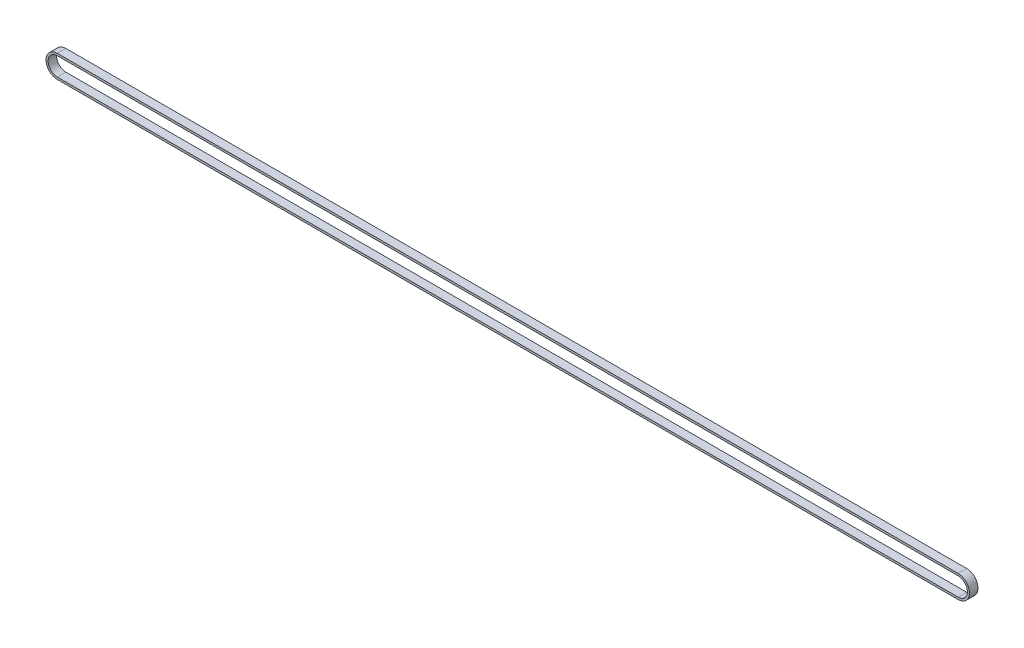
from build123d import *

# Parameters (mm, degrees)
EXTRUDE_THIN1_DEPTH = 3


with BuildPart() as part:
    # Sketch1 → Extrude-Thin1 (new, symmetric)
    with BuildSketch(Plane.XY):
        with BuildLine():
            Line((317.5, 1), (-317.5, 1))
            ThreePointArc((-317.5, 1), (-325.5, -7), (-317.5, -15))
            Line((-317.5, -15), (317.5, -15))
            ThreePointArc((317.5, -15), (325.5, -7), (317.5, 1))
        make_face()
        with BuildLine():
            Line((317.5, -0.5), (-317.5, -0.5))
            ThreePointArc((-317.5, -0.5), (-324, -7), (-317.5, -13.5))
            Line((-317.5, -13.5), (317.5, -13.5))
            ThreePointArc((317.5, -13.5), (324, -7), (317.5, -0.5))
        make_face(mode=Mode.SUBTRACT)
    extrude(amount=EXTRUDE_THIN1_DEPTH, both=True)


solid = part.part
